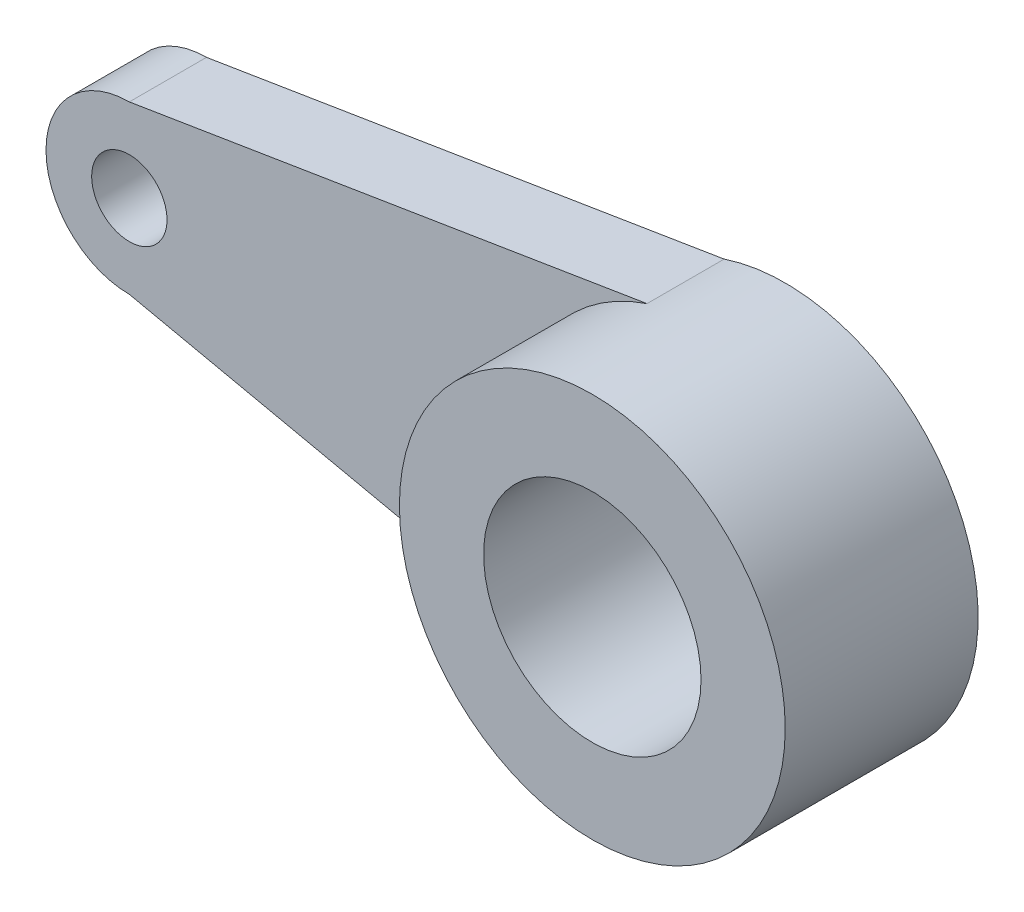
from build123d import *

# Parameters (mm, degrees)
SKETCH_1_R      = 5
SKETCH_1_R_2    = 2.817909336
EXTRUDE_1_DEPTH = 5
SKETCH_2_R      = 0.976753742
EXTRUDE_2_DEPTH = 2


with BuildPart() as part:
    # 草图1 → 凸台-拉伸1 (new body)
    with BuildSketch(Plane.XY):
        with Locations((20.979563361, 15.154638973)):
            Circle(SKETCH_1_R)
        with Locations((20.979563361, 15.154638973)):
            Circle(SKETCH_1_R_2, mode=Mode.SUBTRACT)
    extrude(amount=EXTRUDE_1_DEPTH)

    # 草图2 → 凸台-拉伸2 (add)
    with BuildSketch(Plane(origin=(0, 0, 0), x_dir=(-1, 0, 0), z_dir=(0, 0, -1))):
        with BuildLine():
            Line((-20.979563361, 20.154638973), (-5.979563361, 17.717173943))
            ThreePointArc((-5.979563361, 17.717173943), (-3.819583674, 15.557194255), (-5.979563361, 13.397214568))
            Line((-5.979563361, 13.397214568), (-20.979563361, 10.154638973))
            Line((-20.979563361, 10.154638973), (-20.873226182, 11.0026068))
            Line((-20.873226182, 11.0026068), (-17.89105269, 13.59821912))
            Line((-17.89105269, 13.59821912), (-17.479167483, 16.13293368))
            Line((-17.479167483, 16.13293368), (-20.979563361, 20.154638973))
        make_face()
        with Locations((-5.979563361, 15.557194255)):
            Circle(SKETCH_2_R, mode=Mode.SUBTRACT)
    extrude(amount=-EXTRUDE_2_DEPTH)


solid = part.part
